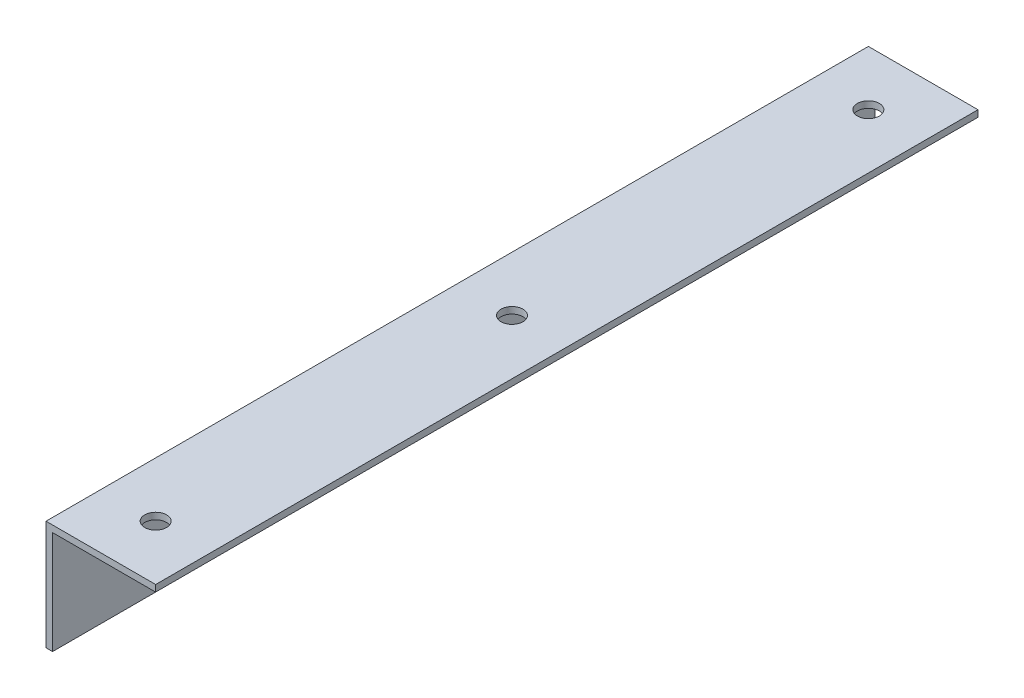
from build123d import *

# Parameters (mm, degrees)
BOSS_EXTRUDE1_DEPTH = 150
SKETCH2_R           = 2
CUT_EXTRUDE1_DEPTH  = 10


with BuildPart() as part:
    # Sketch1 → Boss-Extrude1 (new body)
    with BuildSketch(Plane.XY):
        Polygon((0, 0), (0, 20), (20, 20), (20, 18.8), (1.2, 18.8), (1.2, 0), align=None)
    extrude(amount=BOSS_EXTRUDE1_DEPTH)

    # Sketch2 → Cut-Extrude1 (cut)
    with BuildSketch(Plane(origin=(0, 20, 0), x_dir=(1, 0, 0), z_dir=(0, 1, 0))):
        with Locations(Location((10, -75, 0), (0, 0, 270))):
            Circle(SKETCH2_R)
        with Locations(Location((10, -10, 0), (0, 0, 270))):
            Circle(SKETCH2_R)
        with Locations(Location((10, -140, 0), (0, 0, 270))):
            Circle(SKETCH2_R)
    extrude(amount=-CUT_EXTRUDE1_DEPTH, mode=Mode.SUBTRACT)


solid = part.part
